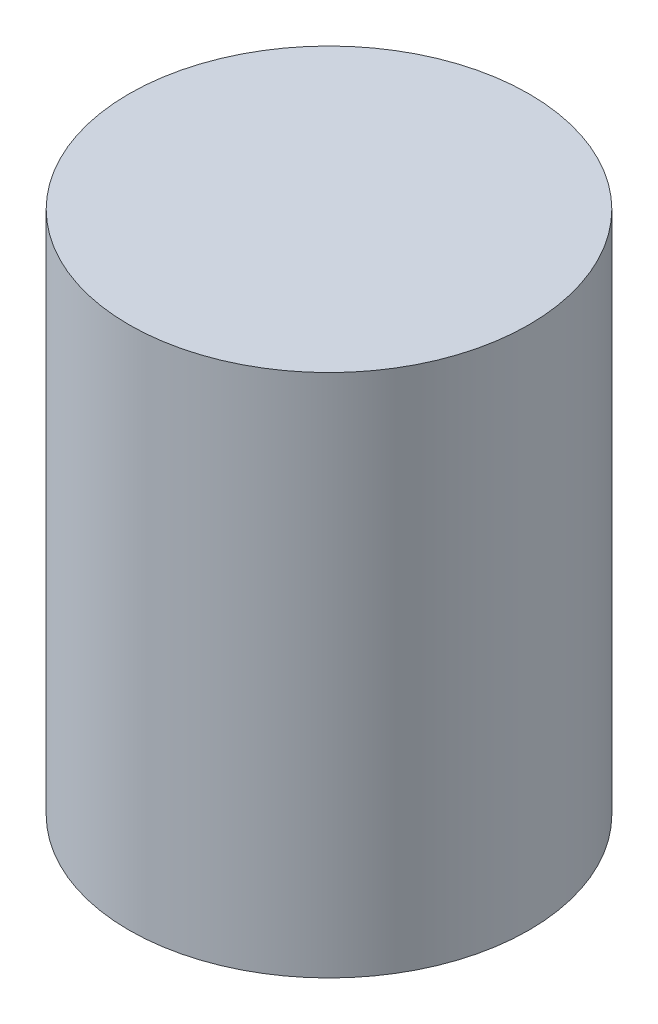
from build123d import *

# Parameters (mm, degrees)
SKETCH1_R           = 24.9
BOSS_EXTRUDE1_DEPTH = 65.278


with BuildPart() as part:
    # Sketch1 → Boss-Extrude1 (new body)
    with BuildSketch(Plane(origin=(0, 0, 0), x_dir=(1, 0, 0), z_dir=(0, 1, 0))):
        with Locations(Location((0, 0, 0), (0, 0, 270))):
            Circle(SKETCH1_R)
    extrude(amount=BOSS_EXTRUDE1_DEPTH)


solid = part.part
